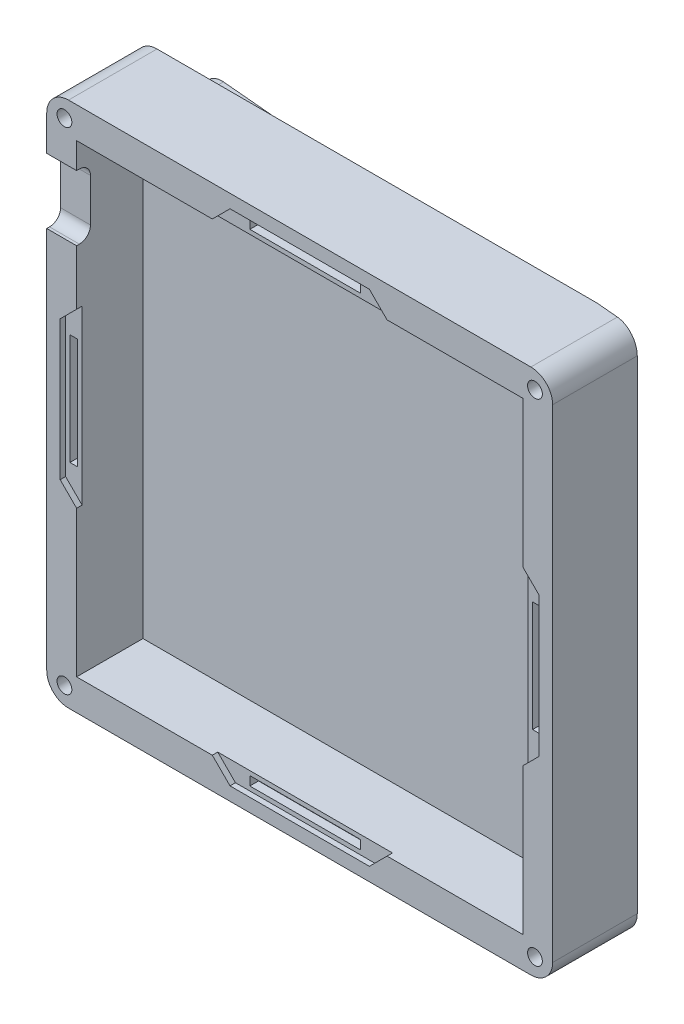
from build123d import *

# Parameters (mm, degrees)
SKETCH1_W                                  = 120.9294
SKETCH1_H                                  = 116.1796
BOSS_EXTRUDE1_DEPTH                        = 5.08
SKETCH2_W                                  = 116.1796
SKETCH2_H                                  = 120.9294
SKETCH2_W_2                                = 102.459137156
SKETCH2_H_2                                = 106.648
BOSS_EXTRUDE2_DEPTH                        = 15.24
CUT_EXTRUDE1_DEPTH                         = 1.25
SKETCH4_W                                  = 25.4
SKETCH4_H                                  = 2.0635
SKETCH4_W_2                                = 1.783031422
SKETCH4_H_2                                = 25.4
CUT_EXTRUDE2_DEPTH                         = 2
CUT_EXTRUDE3_DEPTH                         = 9.906
SKETCH7_R                                  = 3
CUT_EXTRUDE4_DEPTH                         = 12.32
SKETCH8_R                                  = 1.7
CUT_EXTRUDE5_DEPTH                         = 12.32
MIRROR1_AT_THE_SECOND_PLANE_COPY_1_SKETC_R = 3
MIRROR1_AT_THE_SECOND_PLANE_COPY_1_DEPTH   = 12.32
MIRROR1_AT_THE_SECOND_PLANE_COPY_2_SKETC_R = 1.7
MIRROR1_AT_THE_SECOND_PLANE_COPY_2_DEPTH   = 12.32
SKETCH6_W                                  = 109.22
SKETCH6_H                                  = 106.6546
BOSS_EXTRUDE3_DEPTH                        = 9.5504
FILLET1_R                                  = 5.08
FILLET2_R                                  = 5
CUT_EXTRUDE6_DEPTH                         = 18.034
CUT_EXTRUDE6_DEPTH_BACK                    = 130.048


with BuildPart() as part:
    # Sketch1 → Boss-Extrude1 (new body)
    with BuildSketch(Plane(origin=(0, 0, 0), x_dir=(0, 1, 0), z_dir=(0, 0, 1))):
        Rectangle(SKETCH1_W, SKETCH1_H)
    extrude(amount=BOSS_EXTRUDE1_DEPTH)

    # Sketch2 → Boss-Extrude2 (add)
    with BuildSketch(Plane.XY.offset(5.08)):
        Rectangle(SKETCH2_W, SKETCH2_H)
        Rectangle(SKETCH2_W_2, SKETCH2_H_2, mode=Mode.SUBTRACT)
    extrude(amount=BOSS_EXTRUDE2_DEPTH)

    # Sketch3 → Cut-Extrude1 (cut)
    with BuildSketch(Plane.XY.offset(20.32)):
        Polygon((-50.0126, -52.3875), (-21, -52.3875), (-16, -57.3875), (16, -57.3875), (21, -52.3875), (50.0126, -52.3875), (50.0126, -21), (55.0126, -16), (55.0126, 16), (50.0126, 21), (50.0126, 52.3875), (21, 52.3875), (16, 57.3875), (-16, 57.3875), (-21, 52.3875), (-50.0126, 52.3875), (-50.0126, 21), (-55.0126, 16), (-55.0126, -16), (-50.0126, -21), align=None)
    extrude(amount=-CUT_EXTRUDE1_DEPTH, mode=Mode.SUBTRACT)

    # Sketch4 → Cut-Extrude2 (cut)
    with BuildSketch(Plane.XY.offset(19.07)):
        with Locations((0, 55.35575)):
            Rectangle(SKETCH4_W, SKETCH4_H)
        with Locations((0, -55.35575)):
            Rectangle(SKETCH4_W, SKETCH4_H)
        with Locations((-53.121084289, 0)):
            Rectangle(SKETCH4_W_2, SKETCH4_H_2)
        with Locations((53.121084289, 0)):
            Rectangle(SKETCH4_W_2, SKETCH4_H_2)
    extrude(amount=-CUT_EXTRUDE2_DEPTH, mode=Mode.SUBTRACT)

    # Sketch5 → Cut-Extrude3 (cut)
    with BuildSketch(Plane(origin=(-58.0898, 0, 0), x_dir=(0, -1, 0), z_dir=(-1, 0, 0))):
        with BuildLine():
            Line((-44.8211, 26.3172), (-34.9603, 26.3172))
            ThreePointArc((-34.9603, 26.3172), (-33.164248776, 25.573251224), (-32.4203, 23.7772))
            Line((-32.4203, 23.7772), (-32.4203, 19.6822))
            ThreePointArc((-32.4203, 19.6822), (-33.164248776, 17.886148776), (-34.9603, 17.1422))
            Line((-34.9603, 17.1422), (-44.8211, 17.1422))
            ThreePointArc((-44.8211, 17.1422), (-46.617151224, 17.886148776), (-47.3611, 19.6822))
            Line((-47.3611, 19.6822), (-47.3611, 23.7772))
            ThreePointArc((-47.3611, 23.7772), (-46.617151224, 25.573251224), (-44.8211, 26.3172))
        make_face()
    extrude(amount=-CUT_EXTRUDE3_DEPTH, mode=Mode.SUBTRACT)

    # Sketch7 → Cut-Extrude4 (cut)
    with BuildSketch(Plane(origin=(0, 0, 0), x_dir=(1, 0, 0), z_dir=(0, 0, -1))):
        with Locations(Location((-54.0258, 56.4007, 0), (0, 0, 180))):
            Circle(SKETCH7_R)
    cut_extrude4 = extrude(amount=-CUT_EXTRUDE4_DEPTH, mode=Mode.SUBTRACT)

    # Sketch8 → Cut-Extrude5 (cut)
    with BuildSketch(Plane(origin=(0, 0, 12.32), x_dir=(1, 0, 0), z_dir=(0, 0, -1))):
        with Locations(Location((-54.0258, 56.4007, 0), (0, 0, 180))):
            Circle(SKETCH8_R)
    cut_extrude5 = extrude(amount=-CUT_EXTRUDE5_DEPTH, mode=Mode.SUBTRACT)

    # Mirror1: Cut-Extrude4, Cut-Extrude5 across plane
    add(cut_extrude4.mirror(Plane.ZX), mode=Mode.SUBTRACT)
    add(cut_extrude5.mirror(Plane.ZX), mode=Mode.SUBTRACT)

    # Mirror1 at the second plane: Cut-Extrude4, Cut-Extrude5 across plane
    add(cut_extrude4.mirror(Plane(origin=(0, 0, 0), x_dir=(0, 0, 1), z_dir=(1, 0, 0))), mode=Mode.SUBTRACT)
    add(cut_extrude5.mirror(Plane(origin=(0, 0, 0), x_dir=(0, 0, 1), z_dir=(1, 0, 0))), mode=Mode.SUBTRACT)

    # Mirror1 at the second plane copy 1 sketc → Mirror1 at the second plane copy 1 (cut)
    with BuildSketch(Plane(origin=(0, 0, 0), x_dir=(-1, 0, 0), z_dir=(0, 0, -1))):
        with Locations(Location((-54.0258, 56.4007, 0), (0, 0, 180))):
            Circle(MIRROR1_AT_THE_SECOND_PLANE_COPY_1_SKETC_R)
    extrude(amount=-MIRROR1_AT_THE_SECOND_PLANE_COPY_1_DEPTH, mode=Mode.SUBTRACT)

    # Mirror1 at the second plane copy 2 sketc → Mirror1 at the second plane copy 2 (cut)
    with BuildSketch(Plane(origin=(0, 0, 12.32), x_dir=(-1, 0, 0), z_dir=(0, 0, -1))):
        with Locations(Location((-54.0258, 56.4007, 0), (0, 0, 180))):
            Circle(MIRROR1_AT_THE_SECOND_PLANE_COPY_2_SKETC_R)
    extrude(amount=-MIRROR1_AT_THE_SECOND_PLANE_COPY_2_DEPTH, mode=Mode.SUBTRACT)

    # Sketch6 → Boss-Extrude3 (add)
    with BuildSketch(Plane(origin=(0, 0, 0), x_dir=(1, 0, 0), z_dir=(0, 0, -1))):
        with Locations((3.4798, 0)):
            Rectangle(SKETCH6_W, SKETCH6_H)
    extrude(amount=BOSS_EXTRUDE3_DEPTH)

    # Fillet1
    fillet1_edges = [part.edges().sort_by_distance(p)[0] for p in [
        (-51.1302, -53.3273, -4.7752),
        (-51.1302, 53.3273, -4.7752),
    ]]
    fillet(fillet1_edges, radius=FILLET1_R)

    # Fillet2
    fillet2_edges = [part.edges().sort_by_distance(p)[0] for p in [
        (58.0898, 60.4647, 10.16),
        (58.0898, -60.4647, 10.16),
        (-58.0898, -60.4647, 10.16),
        (-58.0898, 60.4647, 10.16),
    ]]
    fillet(fillet2_edges, radius=FILLET2_R)

    # Sketch10 → Cut-Extrude6 (cut, two sides: drawn at the far end of the back side and taken through both)
    with BuildSketch(Plane(origin=(0, 53.3273, 0), x_dir=(-1, 0, 0), z_dir=(0, 1, 0)).offset(-CUT_EXTRUDE6_DEPTH_BACK)):
        Polygon((-58.0898, 0.888884821), (51.1302, -8.666627009), (51.1302, -9.5504), (-58.0898, -9.5504), align=None)
    extrude(amount=CUT_EXTRUDE6_DEPTH + CUT_EXTRUDE6_DEPTH_BACK, mode=Mode.SUBTRACT)


solid = part.part
